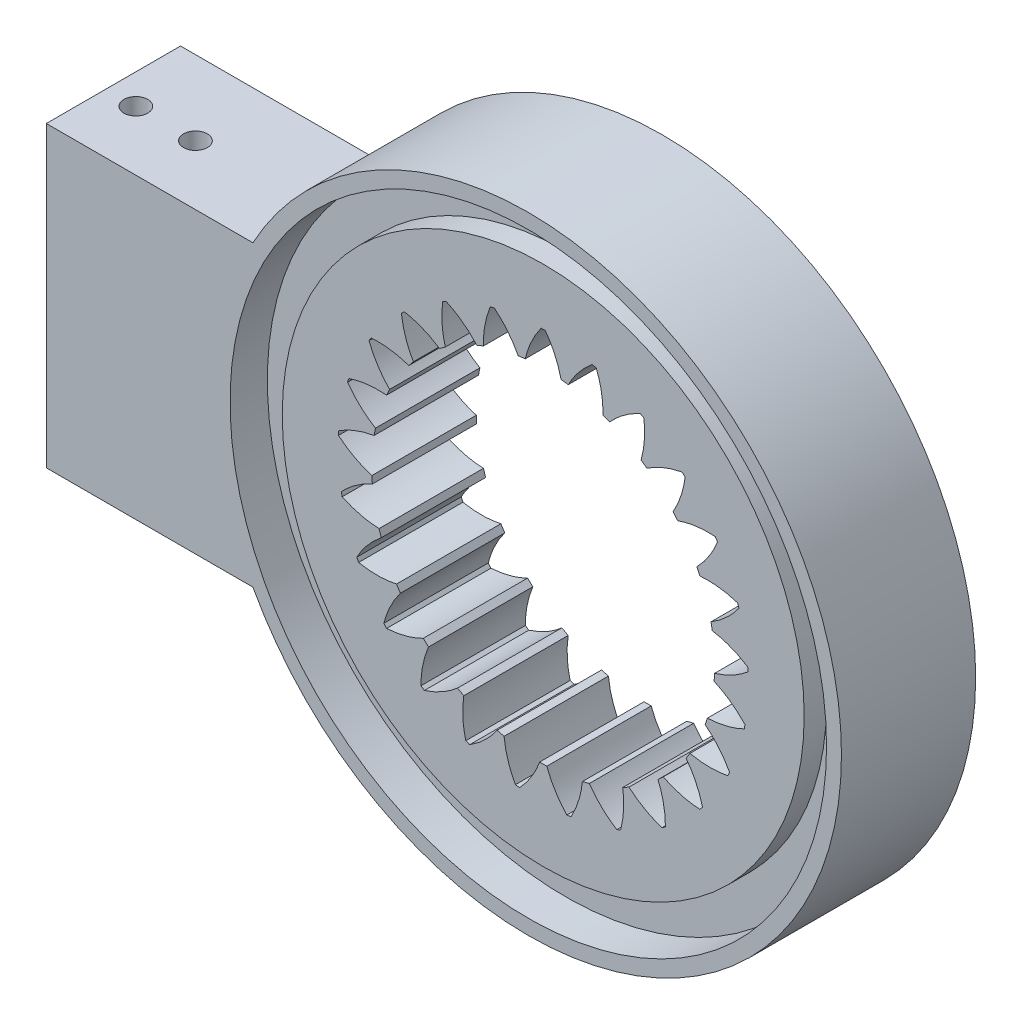
from build123d import *

# Parameters (mm, degrees)
EXTRUDE_1_DEPTH     = 18
SKETCH_2_R          = 40
SKETCH_2_R_2        = 35
CUT_EXTRUDE_1_DEPTH = 5
SKETCH_3_R          = 37.5
CUT_EXTRUDE_2_DEPTH = 2
SKETCH_4_R          = 20
CUT_EXTRUDE_3_DEPTH = 20
CUT_EXTRUDE_START   = -5
SKETCH_5_R          = 40
SKETCH_5_R_2        = 35
CUT_EXTRUDE_4_DEPTH = 5
SKETCH_6_R          = 37.5
CUT_EXTRUDE_5_DEPTH = 2
SKETCH_7_R          = 1.6
CUT_EXTRUDE_6_DEPTH = 60
CUT_EXTRUDE_7_DEPTH = 20


with BuildPart() as part:
    # 草图1 → 凸台-拉伸1 (new body)
    with BuildSketch(Plane.XY):
        with BuildLine():
            Line((0, 0), (0, 40))
            Line((0, 40), (27.708645526, 40))
            ThreePointArc((27.708645526, 40), (106.641016151, 20), (27.708645526, 0))
            Line((27.708645526, 0), (0, 0))
        make_face()
    extrude(amount=EXTRUDE_1_DEPTH)

    # 草图2 → 切除-拉伸1 (cut)
    with BuildSketch(Plane.XY):
        with Locations((64.641016151, 20)):
            Circle(SKETCH_2_R)
        with Locations((64.641016151, 20)):
            Circle(SKETCH_2_R_2, mode=Mode.SUBTRACT)
    extrude(amount=CUT_EXTRUDE_1_DEPTH, mode=Mode.SUBTRACT)

    # 草图3 → 切除-拉伸2 (cut)
    with BuildSketch(Plane.XY):
        with Locations((64.641016151, 20)):
            Circle(SKETCH_3_R)
    extrude(amount=CUT_EXTRUDE_2_DEPTH, mode=Mode.SUBTRACT)

    # 草图4 → 切除-拉伸3 (cut)
    with BuildSketch(Plane.XY):
        with Locations((64.641016151, 20)):
            Circle(SKETCH_4_R)
    extrude(amount=CUT_EXTRUDE_3_DEPTH, mode=Mode.SUBTRACT)

    # 草图5 → 切除-拉伸4 (cut)
    with BuildSketch(Plane.XY.offset(18).offset(CUT_EXTRUDE_START)):
        with Locations((64.641016151, 20)):
            Circle(SKETCH_5_R)
        with Locations((64.641016151, 20)):
            Circle(SKETCH_5_R_2, mode=Mode.SUBTRACT)
    extrude(amount=CUT_EXTRUDE_4_DEPTH, mode=Mode.SUBTRACT)

    # 草图6 → 切除-拉伸5 (cut)
    with BuildSketch(Plane.XY.offset(18)):
        with Locations((64.641016151, 20)):
            Circle(SKETCH_6_R)
    extrude(amount=-CUT_EXTRUDE_5_DEPTH, mode=Mode.SUBTRACT)

    # 草图7 → 切除-拉伸6 (cut)
    with BuildSketch(Plane(origin=(0, 0, 0), x_dir=(1, 0, 0), z_dir=(0, 1, 0))):
        with Locations(Location((4, -10, 0), (0, 0, 90))):
            Circle(SKETCH_7_R)
        with Locations(Location((12, -10, 0), (0, 0, 90))):
            Circle(SKETCH_7_R)
    extrude(amount=CUT_EXTRUDE_6_DEPTH, mode=Mode.SUBTRACT)

    # 草图8 → 切除-拉伸7 (cut)
    with BuildSketch(Plane.XY):
        with BuildLine():
            Line((62.235912919, 42.782971185), (61.28205007, 42.662470284))
            add(Edge.make_bspline(
                [(61.28205007, 42.662470284), (60.083855928, 44.968539597), (58.072452604, 46.614103801)],
                knots=[0, 0, 0, 1, 1, 1], degree=2))
            Line((58.072452604, 46.614103801), (57.53184282, 46.4752988))
            add(Edge.make_bspline(
                [(56.622965086, 41.466220581), (56.561993253, 44.064278954), (57.53184282, 46.4752988)],
                knots=[0, 0, 0, 1, 1, 1], degree=2))
            Line((56.622965086, 41.466220581), (55.729036948, 41.112289393))
            add(Edge.make_bspline(
                [(55.729036948, 41.112289393), (53.994990161, 43.047930532), (51.637543596, 44.141580645)],
                knots=[0, 0, 0, 1, 1, 1], degree=2))
            Line((51.637543596, 44.141580645), (51.148437461, 43.872692272))
            add(Edge.make_bspline(
                [(51.51382089, 38.794954755), (50.808653755, 41.296227269), (51.148437461, 43.872692272)],
                knots=[0, 0, 0, 1, 1, 1], degree=2))
            Line((51.51382089, 38.794954755), (50.735996256, 38.229832079))
            add(Edge.make_bspline(
                [(50.735996256, 38.229832079), (48.57505336, 39.673421592), (46.019690591, 40.146439555)],
                knots=[0, 0, 0, 1, 1, 1], degree=2))
            Line((46.019690591, 40.146439555), (45.612820444, 39.764363056))
            add(Edge.make_bspline(
                [(47.229506651, 34.937019164), (45.924452459, 37.184341667), (45.612820444, 39.764363056)],
                knots=[0, 0, 0, 1, 1, 1], degree=2))
            Line((47.229506651, 34.937019164), (46.616659102, 34.196213735))
            add(Edge.make_bspline(
                [(46.616659102, 34.196213735), (44.164600089, 35.057045584), (41.571883955, 34.87970994)],
                knots=[0, 0, 0, 1, 1, 1], degree=2))
            Line((41.571883955, 34.87970994), (41.272814944, 34.408452585))
            add(Edge.make_bspline(
                [(44.039221588, 30.134822089), (42.216281694, 31.986987044), (41.272814944, 34.408452585)],
                knots=[0, 0, 0, 1, 1, 1], degree=2))
            Line((44.039221588, 30.134822089), (43.629858591, 29.264881437))
            add(Edge.make_bspline(
                [(43.629858591, 29.264881437), (41.040755345, 29.488866391), (38.573595738, 28.67231979)],
                knots=[0, 0, 0, 1, 1, 1], degree=2))
            Line((38.573595738, 28.67231979), (38.401119468, 28.141492413))
            add(Edge.make_bspline(
                [(42.143423047, 24.690103233), (39.917139468, 26.030732304), (38.401119468, 28.141492413)],
                knots=[0, 0, 0, 1, 1, 1], degree=2))
            Line((42.143423047, 24.690103233), (41.963266383, 23.74568893))
            add(Edge.make_bspline(
                [(41.963266383, 23.74568893), (39.399801784, 23.31875319), (37.213219415, 21.914302257)],
                knots=[0, 0, 0, 1, 1, 1], degree=2))
            Line((37.213219415, 21.914302257), (37.178173205, 21.357258695))
            add(Edge.make_bspline(
                [(41.66123102, 18.944974307), (39.171489341, 19.689830838), (37.178173205, 21.357258695)],
                knots=[0, 0, 0, 1, 1, 1], degree=2))
            Line((41.66123102, 18.944974307), (41.721600596, 17.985427375))
            add(Edge.make_bspline(
                [(41.721600596, 17.985427375), (39.344846552, 16.934396885), (37.576232433, 15.030288439)],
                knots=[0, 0, 0, 1, 1, 1], degree=2))
            Line((37.576232433, 15.030288439), (37.680818365, 14.482029786))
            add(Edge.make_bspline(
                [(42.622943407, 13.260422891), (40.026183255, 13.362704807), (37.680818365, 14.482029786)],
                knots=[0, 0, 0, 1, 1, 1], degree=2))
            Line((42.622943407, 13.260422891), (42.92004598, 12.346035193))
            add(Edge.make_bspline(
                [(42.92004598, 12.346035193), (40.879342688, 10.736950063), (39.639825349, 8.452826239)],
                knots=[0, 0, 0, 1, 1, 1], degree=2))
            Line((39.639825349, 8.452826239), (39.877471904, 7.947801604))
            add(Edge.make_bspline(
                [(44.968132281, 7.993630255), (42.427517646, 7.446910807), (39.877471904, 7.947801604)],
                knots=[0, 0, 0, 1, 1, 1], degree=2))
            Line((44.968132281, 7.993630255), (45.483299804, 7.181856133))
            add(Edge.make_bspline(
                [(45.483299804, 7.181856133), (43.906872158, 5.115821101), (43.274335032, 2.5952018)],
                knots=[0, 0, 0, 1, 1, 1], degree=2))
            Line((43.274335032, 2.5952018), (43.630110003, 2.165143736))
            add(Edge.make_bspline(
                [(48.549440801, 3.475528351), (46.224607844, 2.314159933), (43.630110003, 2.165143736)],
                knots=[0, 0, 0, 1, 1, 1], degree=2))
            Line((48.549440801, 3.475528351), (49.250303403, 2.817374559))
            add(Edge.make_bspline(
                [(49.250303403, 2.817374559), (48.23720415, 0.424206203), (48.25139187, -2.174528794)],
                knots=[0, 0, 0, 1, 1, 1], degree=2))
            Line((48.25139187, -2.174528794), (48.702940607, -2.502598155))
            add(Edge.make_bspline(
                [(53.14184218, -0.009993862), (51.178868707, -1.713038201), (48.702940607, -2.502598155)],
                knots=[0, 0, 0, 1, 1, 1], degree=2))
            Line((53.14184218, -0.009993862), (53.984362088, -0.4731731))
            add(Edge.make_bspline(
                [(53.984362088, -0.4731731), (53.598247979, -3.043103211), (54.258269079, -5.556665827)],
                knots=[0, 0, 0, 1, 1, 1], degree=2))
            Line((54.258269079, -5.556665827), (54.777219114, -5.762132681))
            add(Edge.make_bspline(
                [(58.456778952, -2.243928204), (56.979005804, -4.381639925), (54.777219114, -5.762132681)],
                knots=[0, 0, 0, 1, 1, 1], degree=2))
            Line((58.456778952, -2.243928204), (59.388017539, -2.483029634))
            add(Edge.make_bspline(
                [(59.388017539, -2.483029634), (59.653149544, -5.068243339), (60.917532471, -7.33869719)],
                knots=[0, 0, 0, 1, 1, 1], degree=2))
            Line((60.917532471, -7.33869719), (61.471276266, -7.408651299))
            add(Edge.make_bspline(
                [(64.16029409, -3.085908365), (63.26057519, -5.523967178), (61.471276266, -7.408651299)],
                knots=[0, 0, 0, 1, 1, 1], degree=2))
            Line((64.16029409, -3.085908365), (65.121738213, -3.085908365))
            add(Edge.make_bspline(
                [(65.121738213, -3.085908365), (66.021457113, -5.523967178), (67.810756037, -7.408651299)],
                knots=[0, 0, 0, 1, 1, 1], degree=2))
            Line((67.810756037, -7.408651299), (68.364499832, -7.33869719))
            add(Edge.make_bspline(
                [(69.894014764, -2.483029634), (69.628882759, -5.068243339), (68.364499832, -7.33869719)],
                knots=[0, 0, 0, 1, 1, 1], degree=2))
            Line((69.894014764, -2.483029634), (70.825253351, -2.243928204))
            add(Edge.make_bspline(
                [(70.825253351, -2.243928204), (72.303026499, -4.381639925), (74.504813189, -5.762132681)],
                knots=[0, 0, 0, 1, 1, 1], degree=2))
            Line((74.504813189, -5.762132681), (75.023763224, -5.556665827))
            add(Edge.make_bspline(
                [(75.297670215, -0.4731731), (75.683784324, -3.043103211), (75.023763224, -5.556665827)],
                knots=[0, 0, 0, 1, 1, 1], degree=2))
            Line((75.297670215, -0.4731731), (76.140190122, -0.009993862))
            add(Edge.make_bspline(
                [(76.140190122, -0.009993862), (78.103163596, -1.713038201), (80.579091696, -2.502598155)],
                knots=[0, 0, 0, 1, 1, 1], degree=2))
            Line((80.579091696, -2.502598155), (81.030640433, -2.174528794))
            add(Edge.make_bspline(
                [(80.0317289, 2.817374559), (81.044828153, 0.424206203), (81.030640433, -2.174528794)],
                knots=[0, 0, 0, 1, 1, 1], degree=2))
            Line((80.0317289, 2.817374559), (80.732591502, 3.475528351))
            add(Edge.make_bspline(
                [(80.732591502, 3.475528351), (83.057424458, 2.314159933), (85.6519223, 2.165143736)],
                knots=[0, 0, 0, 1, 1, 1], degree=2))
            Line((85.6519223, 2.165143736), (86.007697271, 2.5952018))
            add(Edge.make_bspline(
                [(83.798732499, 7.181856133), (85.375160145, 5.115821101), (86.007697271, 2.5952018)],
                knots=[0, 0, 0, 1, 1, 1], degree=2))
            Line((83.798732499, 7.181856133), (84.313900021, 7.993630255))
            add(Edge.make_bspline(
                [(84.313900021, 7.993630255), (86.854514656, 7.446910807), (89.404560399, 7.947801604)],
                knots=[0, 0, 0, 1, 1, 1], degree=2))
            Line((89.404560399, 7.947801604), (89.642206953, 8.452826239))
            add(Edge.make_bspline(
                [(86.361986323, 12.346035193), (88.402689614, 10.736950063), (89.642206953, 8.452826239)],
                knots=[0, 0, 0, 1, 1, 1], degree=2))
            Line((86.361986323, 12.346035193), (86.659088896, 13.260422891))
            add(Edge.make_bspline(
                [(86.659088896, 13.260422891), (89.255849048, 13.362704807), (91.601213938, 14.482029786)],
                knots=[0, 0, 0, 1, 1, 1], degree=2))
            Line((91.601213938, 14.482029786), (91.70579987, 15.030288439))
            add(Edge.make_bspline(
                [(87.560431707, 17.985427375), (89.937185751, 16.934396885), (91.70579987, 15.030288439)],
                knots=[0, 0, 0, 1, 1, 1], degree=2))
            Line((87.560431707, 17.985427375), (87.620801283, 18.944974307))
            add(Edge.make_bspline(
                [(87.620801283, 18.944974307), (90.110542961, 19.689830838), (92.103859098, 21.357258695)],
                knots=[0, 0, 0, 1, 1, 1], degree=2))
            Line((92.103859098, 21.357258695), (92.068812888, 21.914302257))
            add(Edge.make_bspline(
                [(87.31876592, 23.74568893), (89.882230519, 23.31875319), (92.068812888, 21.914302257)],
                knots=[0, 0, 0, 1, 1, 1], degree=2))
            Line((87.31876592, 23.74568893), (87.138609256, 24.690103233))
            add(Edge.make_bspline(
                [(87.138609256, 24.690103233), (89.364892835, 26.030732304), (90.880912834, 28.141492413)],
                knots=[0, 0, 0, 1, 1, 1], degree=2))
            Line((90.880912834, 28.141492413), (90.708436564, 28.67231979))
            add(Edge.make_bspline(
                [(85.652173712, 29.264881437), (88.241276958, 29.488866391), (90.708436564, 28.67231979)],
                knots=[0, 0, 0, 1, 1, 1], degree=2))
            Line((85.652173712, 29.264881437), (85.242810714, 30.134822089))
            add(Edge.make_bspline(
                [(85.242810714, 30.134822089), (87.065750609, 31.986987044), (88.009217358, 34.408452585)],
                knots=[0, 0, 0, 1, 1, 1], degree=2))
            Line((88.009217358, 34.408452585), (87.710148347, 34.87970994))
            add(Edge.make_bspline(
                [(82.665373201, 34.196213735), (85.117432214, 35.057045584), (87.710148347, 34.87970994)],
                knots=[0, 0, 0, 1, 1, 1], degree=2))
            Line((82.665373201, 34.196213735), (82.052525652, 34.937019164))
            add(Edge.make_bspline(
                [(82.052525652, 34.937019164), (83.357579844, 37.184341667), (83.669211858, 39.764363056)],
                knots=[0, 0, 0, 1, 1, 1], degree=2))
            Line((83.669211858, 39.764363056), (83.262341712, 40.146439555))
            add(Edge.make_bspline(
                [(78.546036047, 38.229832079), (80.706978942, 39.673421592), (83.262341712, 40.146439555)],
                knots=[0, 0, 0, 1, 1, 1], degree=2))
            Line((78.546036047, 38.229832079), (77.768211413, 38.794954755))
            add(Edge.make_bspline(
                [(77.768211413, 38.794954755), (78.473378548, 41.296227269), (78.133594841, 43.872692272)],
                knots=[0, 0, 0, 1, 1, 1], degree=2))
            Line((78.133594841, 43.872692272), (77.644488707, 44.141580645))
            add(Edge.make_bspline(
                [(73.552995355, 41.112289393), (75.287042142, 43.047930532), (77.644488707, 44.141580645)],
                knots=[0, 0, 0, 1, 1, 1], degree=2))
            Line((73.552995355, 41.112289393), (72.659067217, 41.466220581))
            add(Edge.make_bspline(
                [(72.659067217, 41.466220581), (72.72003905, 44.064278954), (71.750189483, 46.4752988)],
                knots=[0, 0, 0, 1, 1, 1], degree=2))
            Line((71.750189483, 46.4752988), (71.209579698, 46.614103801))
            add(Edge.make_bspline(
                [(67.999982233, 42.662470284), (69.198176375, 44.968539597), (71.209579698, 46.614103801)],
                knots=[0, 0, 0, 1, 1, 1], degree=2))
            Line((67.999982233, 42.662470284), (67.046119384, 42.782971185))
            add(Edge.make_bspline(
                [(67.046119384, 42.782971185), (66.459064831, 45.314569855), (64.920088618, 47.408651299)],
                knots=[0, 0, 0, 1, 1, 1], degree=2))
            Line((64.920088618, 47.408651299), (64.361943684, 47.408651299))
            add(Edge.make_bspline(
                [(62.235912919, 42.782971185), (62.822967472, 45.314569855), (64.361943684, 47.408651299)],
                knots=[0, 0, 0, 1, 1, 1], degree=2))
        make_face()
    extrude(amount=CUT_EXTRUDE_7_DEPTH, mode=Mode.SUBTRACT)


solid = part.part
